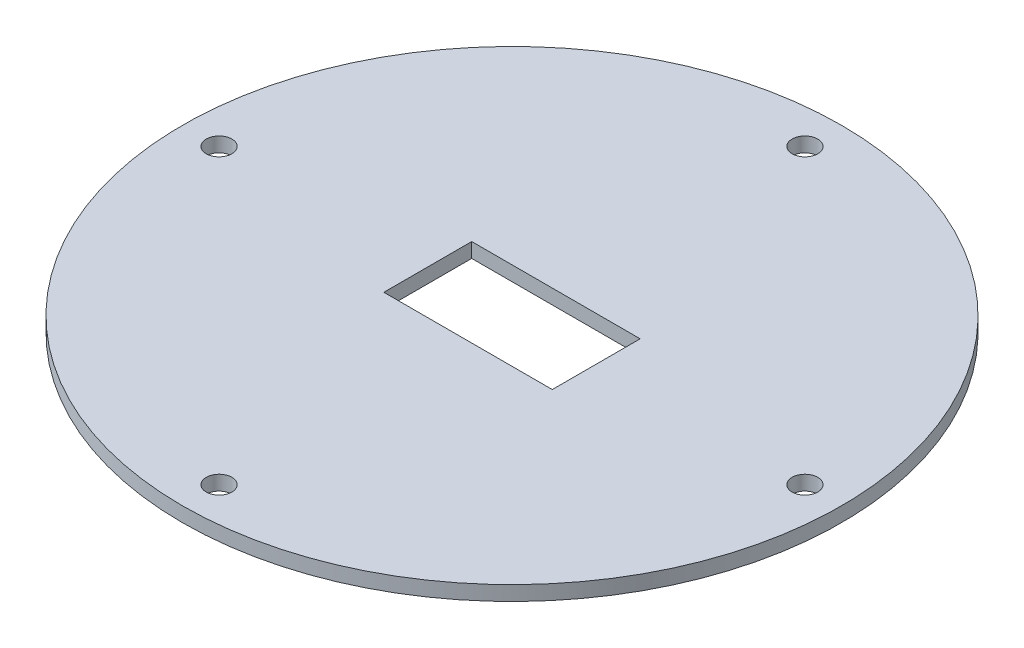
from build123d import *

# Parameters (mm, degrees)
SKETCH2_R           = 45
BOSS_EXTRUDE1_DEPTH = 2
SKETCH4_R           = 1.75
CUT_EXTRUDE1_DEPTH  = 64.671029519
SKETCH5_W           = 23
SKETCH5_H           = 12
CUT_EXTRUDE2_DEPTH  = 64.671029519


with BuildPart() as part:
    # Sketch2 → Boss-Extrude1 (new body)
    with BuildSketch(Plane(origin=(0, 0, 0), x_dir=(1, 0, 0), z_dir=(0, 1, 0))):
        with Locations(Location((0, 0, 0), (0, 0, 270))):
            Circle(SKETCH2_R)
    extrude(amount=BOSS_EXTRUDE1_DEPTH)

    # Sketch4 → Cut-Extrude1 (cut, through all)
    with BuildSketch(Plane(origin=(0, 2, 0), x_dir=(1, 0, 0), z_dir=(0, 1, 0))):
        with Locations(Location((0, 40, 0), (0, 0, 270))):
            Circle(SKETCH4_R)
        with Locations(Location((40, 0, 0), (0, 0, 270))):
            Circle(SKETCH4_R)
        with Locations(Location((0, -40, 0), (0, 0, 270))):
            Circle(SKETCH4_R)
        with Locations(Location((-40, 0, 0), (0, 0, 270))):
            Circle(SKETCH4_R)
    extrude(amount=-CUT_EXTRUDE1_DEPTH, mode=Mode.SUBTRACT)

    # Sketch5 → Cut-Extrude2 (cut, through all)
    with BuildSketch(Plane.XZ):
        Rectangle(SKETCH5_W, SKETCH5_H)
    extrude(amount=-CUT_EXTRUDE2_DEPTH, mode=Mode.SUBTRACT)


solid = part.part
